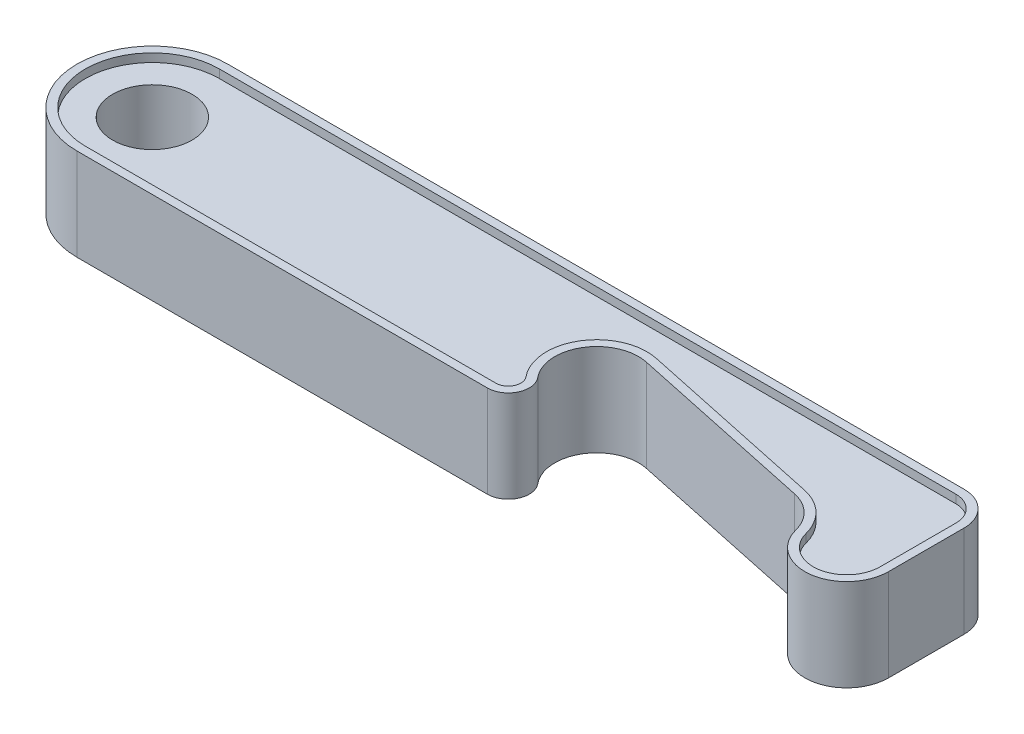
from build123d import *

# Parameters (mm, degrees)
BOSS_EXTRUDE1_DEPTH = 5.5
SKETCH2_3_R         = 4.75
BOSS_EXTRUDE2_DEPTH = 4.5


with BuildPart() as part:
    # Sketch2 → Boss-Extrude1 (new, symmetric)
    with BuildSketch(Plane(origin=(0, 0, 0), x_dir=(1, 0, 0), z_dir=(0, 1, 0))):
        with BuildLine():
            Line((0, 9), (88, 9))
            ThreePointArc((88, 9), (90.828427125, 7.828427125), (92, 5))
            Line((92, 5), (92, -4.038605995))
            ThreePointArc((92, -4.038605995), (87.6201367, -9), (82.153827811, -5.269302997))
            ThreePointArc((82.153827811, -5.269302997), (80.773118265, -2.895756853), (78.347214076, -1.609261996))
            Line((78.347214076, -1.609261996), (55.847214076, 3.173260641))
            ThreePointArc((55.847214076, 3.173260641), (50.53042136, 0.871975682), (50.956106022, -4.905825787))
            ThreePointArc((50.956106022, -4.905825787), (51.292568558, -7.564087513), (49.030331222, -9))
            Line((49.030331222, -9), (0, -9))
            ThreePointArc((0, -9), (-9, 0), (0, 9))
        make_face()
        with BuildLine():
            Line((0, 8), (88, 8))
            ThreePointArc((88, 8), (90.121320344, 7.121320344), (91, 5))
            Line((91, 5), (91, -4.038605995))
            ThreePointArc((91, -4.038605995), (87.49610936, -8.007721199), (83.123062249, -5.023163597))
            ThreePointArc((83.123062249, -5.023163597), (81.466210794, -2.174908223), (78.555125766, -0.631114396))
            Line((78.555125766, -0.631114396), (56.055125766, 4.151408242))
            ThreePointArc((56.055125766, 4.151408242), (49.674974507, 1.389866291), (50.185796102, -5.543495472))
            ThreePointArc((50.185796102, -5.543495472), (50.387673623, -7.138452508), (49.030331222, -8))
            Line((49.030331222, -8), (0, -8))
            ThreePointArc((0, -8), (-8, 0), (0, 8))
        make_face(mode=Mode.SUBTRACT)
    extrude(amount=BOSS_EXTRUDE1_DEPTH, both=True)

    # Sketch2<3> → Boss-Extrude2 (add, symmetric)
    with BuildSketch(Plane(origin=(0, 0, 0), x_dir=(1, 0, 0), z_dir=(0, 1, 0))):
        with BuildLine():
            Line((88, 8), (0, 8))
            ThreePointArc((0, 8), (-8, 0), (0, -8))
            Line((0, -8), (49.030331222, -8))
            ThreePointArc((49.030331222, -8), (50.387673623, -7.138452508), (50.185796102, -5.543495472))
            ThreePointArc((50.185796102, -5.543495472), (49.674974507, 1.389866291), (56.055125766, 4.151408242))
            Line((56.055125766, 4.151408242), (78.555125766, -0.631114396))
            ThreePointArc((78.555125766, -0.631114396), (81.466210794, -2.174908223), (83.123062249, -5.023163597))
            ThreePointArc((83.123062249, -5.023163597), (87.49610936, -8.007721199), (91, -4.038605995))
            Line((91, -4.038605995), (91, 5))
            ThreePointArc((91, 5), (90.121320344, 7.121320344), (88, 8))
        make_face()
        Circle(SKETCH2_3_R, mode=Mode.SUBTRACT)
    extrude(amount=BOSS_EXTRUDE2_DEPTH, both=True)


solid = part.part
